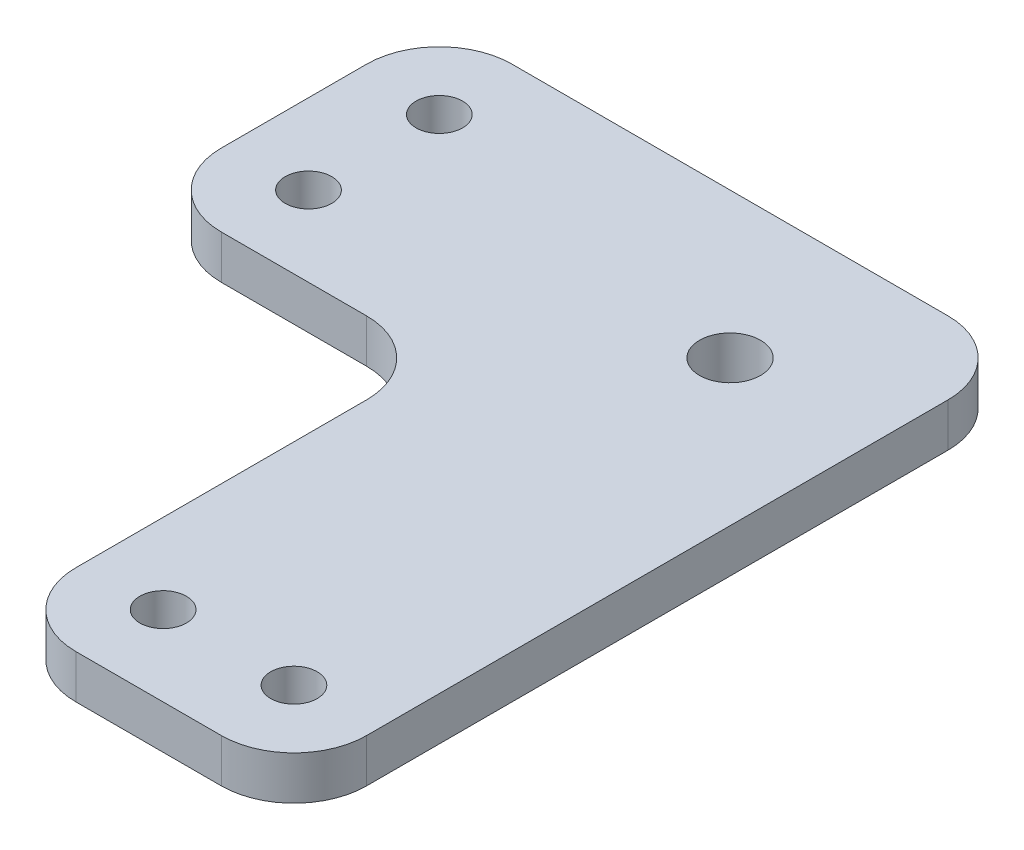
from build123d import *

# Parameters (mm, degrees)
EXTRUDE_1_DEPTH     = 3
SKETCH_2_R          = 1.6
CUT_EXTRUDE_1_DEPTH = 47.19523785
FILLET_1_R          = 5
SKETCH_3_R          = 2.1
CUT_EXTRUDE_2_DEPTH = 47.19523785


with BuildPart() as part:
    # 草图1 → 凸台-拉伸1 (new body)
    with BuildSketch(Plane(origin=(0, 0, 0), x_dir=(1, 0, 0), z_dir=(0, 1, 0))):
        Polygon((-30, 35), (-30, 15), (-10, 15), (-10, -15), (10, -15), (10, 35), align=None)
    extrude(amount=EXTRUDE_1_DEPTH)

    # 草图2 → 切除-拉伸1 (cut, through all)
    with BuildSketch(Plane(origin=(0, 3, 0), x_dir=(1, 0, 0), z_dir=(0, 1, 0))):
        with Locations(Location((-24.5, 29.5, 0), (0, 0, 270))):
            Circle(SKETCH_2_R)
        with Locations(Location((-24.5, 20.5, 0), (0, 0, 270))):
            Circle(SKETCH_2_R)
        with Locations(Location((-4.5, -9.5, 0), (0, 0, 270))):
            Circle(SKETCH_2_R)
        with Locations(Location((4.5, -9.5, 0), (0, 0, 270))):
            Circle(SKETCH_2_R)
    extrude(amount=-CUT_EXTRUDE_1_DEPTH, mode=Mode.SUBTRACT)

    # 圆角1
    fillet_1_edges = [part.edges().sort_by_distance(p)[0] for p in [
        (10, 1.5, 15),
        (-10, 1.5, 15),
        (-10, 1.5, -15),
        (-30, 1.5, -15),
        (-30, 1.5, -35),
        (10, 1.5, -35),
    ]]
    fillet(fillet_1_edges, radius=FILLET_1_R)

    # 草图3 → 切除-拉伸2 (cut, through all)
    with BuildSketch(Plane(origin=(0, 3, 0), x_dir=(1, 0, 0), z_dir=(0, 1, 0))):
        with Locations(Location((0, 25, 0), (0, 0, 270))):
            Circle(SKETCH_3_R)
    extrude(amount=-CUT_EXTRUDE_2_DEPTH, mode=Mode.SUBTRACT)


solid = part.part
